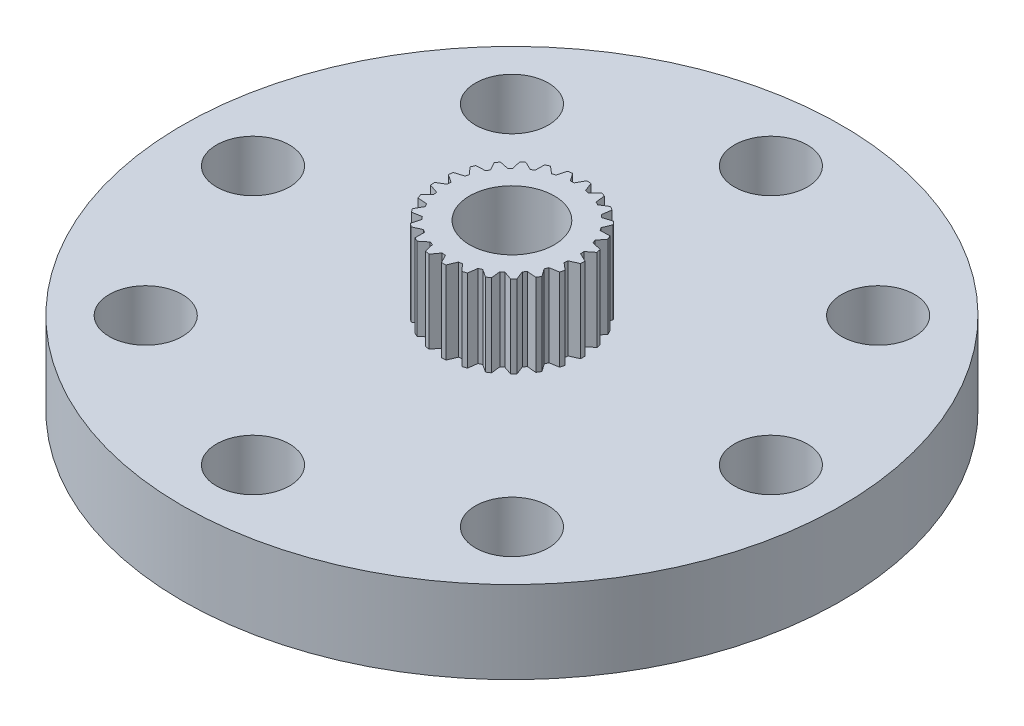
from build123d import *

# Parameters (mm, degrees)
SKETCH1_R                  = 14
BOSS_EXTRUDE1_DEPTH        = 1.75
M2_5_CLEARANCE_HOLE1_D     = 3.1
M2_5_CLEARANCE_HOLE1_DEPTH = 6
M2_5_CLEARANCE_HOLE1_TIP   = 0.931333959
SKETCH7_R                  = 5
CUT_EXTRUDE1_DEPTH         = 2.3
BOSS_EXTRUDE3_DEPTH        = 3.5
M3_CLEARANCE_HOLE1_D       = 3.6
M3_CLEARANCE_HOLE1_DEPTH   = 6
M3_CLEARANCE_HOLE1_TIP     = 1.081549114


with BuildPart() as part:
    # Sketch1 → Boss-Extrude1 (new, symmetric)
    with BuildSketch(Plane(origin=(0, 0, 0), x_dir=(1, 0, 0), z_dir=(0, 1, 0))):
        with Locations(Location((0, 0, 0), (0, 0, 270))):
            Circle(SKETCH1_R)
    extrude(amount=BOSS_EXTRUDE1_DEPTH, both=True)

    # M2.5 Clearance Hole1
    with Locations(Plane(origin=(0, 1.75, 0), x_dir=(1, 0, 0), z_dir=(0, 1, 0))):
        with Locations((-11, 0), (-7.778174593, 7.778174593), (0, 11), (7.778174593, 7.778174593), (11, 0), (7.778174593, -7.778174593), (0, -11), (-7.778174593, -7.778174593)):
            Hole(M2_5_CLEARANCE_HOLE1_D / 2, depth=M2_5_CLEARANCE_HOLE1_DEPTH)
            with Locations((0, 0, -(M2_5_CLEARANCE_HOLE1_DEPTH + M2_5_CLEARANCE_HOLE1_TIP / 2))):  # 118° drill point
                Cone(0, M2_5_CLEARANCE_HOLE1_D / 2, M2_5_CLEARANCE_HOLE1_TIP, mode=Mode.SUBTRACT)

    # Sketch7 → Cut-Extrude1 (cut)
    with BuildSketch(Plane.XZ.offset(1.75)):
        with Locations(Location((0, 0, 0), (0, 0, 270))):
            Circle(SKETCH7_R)
    extrude(amount=-CUT_EXTRUDE1_DEPTH, mode=Mode.SUBTRACT)

    # Sketch8 → Boss-Extrude3 (add)
    with BuildSketch(Plane(origin=(0, 1.75, 0), x_dir=(1, 0, 0), z_dir=(0, 1, 0))):
        with BuildLine():
            Line((-0.128852443, -2.696923627), (0.057352661, -3.049460718))
            ThreePointArc((0.057352661, -3.049460718), (0.151245078, -3.04624768), (0.244993995, -3.040144395))
            Line((0.244993995, -3.040144395), (0.395362741, -2.670896535))
            ThreePointArc((0.395362741, -2.670896535), (0.470816738, -2.658633408), (0.545893326, -2.644239111))
            Line((0.545893326, -2.644239111), (0.813920864, -2.939393275))
            ThreePointArc((0.813920864, -2.939393275), (0.904064427, -2.912931086), (0.993350224, -2.883705139))
            Line((0.993350224, -2.883705139), (1.047166652, -2.488662694))
            ThreePointArc((1.047166652, -2.488662694), (1.117200406, -2.458020189), (1.18633861, -2.425407327))
            Line((1.18633861, -2.425407327), (1.519347425, -2.644632943))
            ThreePointArc((1.519347425, -2.644632943), (1.600078084, -2.596584319), (1.679290606, -2.546072084))
            Line((1.679290606, -2.546072084), (1.63317323, -2.150057022))
            ThreePointArc((1.63317323, -2.150057022), (1.693386265, -2.102960522), (1.752241875, -2.054178281))
            Line((1.752241875, -2.054178281), (2.1293078, -2.183700596))
            ThreePointArc((2.1293078, -2.183700596), (2.19555295, -2.11708461), (2.259714983, -2.048459957))
            Line((2.259714983, -2.048459957), (2.116561528, -1.676355361))
            ThreePointArc((2.116561528, -1.676355361), (2.163170436, -1.615764111), (2.208045339, -1.553877659))
            Line((2.208045339, -1.553877659), (2.605475935, -1.58555831))
            ThreePointArc((2.605475935, -1.58555831), (2.653073149, -1.504560688), (2.698153157, -1.422135556))
            Line((2.698153157, -1.422135556), (2.466958481, -1.097322127))
            ThreePointArc((2.466958481, -1.097322127), (2.497034654, -1.027043299), (2.525109194, -0.955941189))
            Line((2.525109194, -0.955941189), (2.917932434, -0.887789563))
            ThreePointArc((2.917932434, -0.887789563), (2.943891005, -0.797499685), (2.967056445, -0.706453148))
            Line((2.967056445, -0.706453148), (2.66234736, -0.449340108))
            ThreePointArc((2.66234736, -0.449340108), (2.674001, -0.373789578), (2.683511152, -0.297939418))
            Line((2.683511152, -0.297939418), (3.047044507, -0.134237734))
            ThreePointArc((3.047044507, -0.134237734), (3.049733363, -0.040328844), (3.049528665, 0.053618309))
            Line((3.049528665, 0.053618309), (2.690451163, 0.226875602))
            ThreePointArc((2.690451163, 0.226875602), (2.68295003, 0.302950716), (2.673298235, 0.378782983))
            Line((2.673298235, 0.378782983), (2.984699568, 0.627748746))
            ThreePointArc((2.984699568, 0.627748746), (2.963949757, 0.719376006), (2.940387783, 0.810320731))
            Line((2.940387783, 0.810320731), (2.549504025, 0.888835884))
            ThreePointArc((2.549504025, 0.888835884), (2.523319442, 0.960655502), (2.495112158, 1.031705055))
            Line((2.495112158, 1.031705055), (2.734814978, 1.350291464))
            ThreePointArc((2.734814978, 1.350291464), (2.691930287, 1.433879817), (2.646491522, 1.516107721))
            Line((2.646491522, 1.516107721), (2.248362172, 1.494947338))
            ThreePointArc((2.248362172, 1.494947338), (2.205139413, 1.55799877), (2.160149007, 1.619801305))
            Line((2.160149007, 1.619801305), (2.313091905, 1.987990402))
            ThreePointArc((2.313091905, 1.987990402), (2.250766937, 2.058287685), (2.186306467, 2.126632087))
            Line((2.186306467, 2.126632087), (1.805947455, 2.007125753))
            ThreePointArc((1.805947455, 2.007125753), (1.748402365, 2.057447246), (1.68945575, 2.106119481))
            Line((1.68945575, 2.106119481), (1.74602876, 2.500776593))
            ThreePointArc((1.74602876, 2.500776593), (1.668179623, 2.553365768), (1.588747735, 2.603532338))
            Line((1.588747735, 2.603532338), (1.250058417, 2.393189076))
            ThreePointArc((1.250058417, 2.393189076), (1.181806766, 2.427618744), (1.112607775, 2.460102424))
            Line((1.112607775, 2.460102424), (1.069256207, 2.856429793))
            ThreePointArc((1.069256207, 2.856429793), (0.980774447, 2.888006489), (0.89136214, 2.916843077))
            Line((0.89136214, 2.916843077), (0.615623612, 2.628879527))
            ThreePointArc((0.615623612, 2.628879527), (0.540953902, 2.645254028), (0.465850562, 2.659508085))
            Line((0.465850562, 2.659508085), (0.325298354, 3.032603004))
            ThreePointArc((0.325298354, 3.032603004), (0.231743607, 3.041183141), (0.137968984, 3.046877838))
            Line((0.137968984, 3.046877838), (-0.057493089, 2.699387809))
            ThreePointArc((-0.057493089, 2.699387809), (-0.133889085, 2.696678274), (-0.210177756, 2.691807071))
            Line((-0.210177756, 2.691807071), (-0.439099191, 3.018226615))
            ThreePointArc((-0.439099191, 3.018226615), (-0.531848537, 3.003271072), (-0.624093271, 2.985466059))
            Line((-0.624093271, 2.985466059), (-0.726997287, 2.600283627))
            ThreePointArc((-0.726997287, 2.600283627), (-0.800319329, 2.578660305), (-0.872999832, 2.55496992))
            Line((-0.872999832, 2.55496992), (-1.175906519, 2.814203948))
            ThreePointArc((-1.175906519, 2.814203948), (-1.262022681, 2.776652436), (-1.346941451, 2.736466467))
            Line((-1.346941451, 2.736466467), (-1.350821572, 2.337794062))
            ThreePointArc((-1.350821572, 2.337794062), (-1.416462566, 2.298615626), (-1.480968118, 2.257594612))
            Line((-1.480968118, 2.257594612), (-1.838827315, 2.433354496))
            ThreePointArc((-1.838827315, 2.433354496), (-1.912899299, 2.375566516), (-1.985156345, 2.315524624))
            Line((-1.985156345, 2.315524624), (-1.88976877, 1.928412299))
            ThreePointArc((-1.88976877, 1.928412299), (-1.943604251, 1.874140474), (-1.995881731, 1.818366332))
            Line((-1.995881731, 1.818366332), (-2.386207829, 1.899608433))
            ThreePointArc((-2.386207829, 1.899608433), (-2.443581419, 1.825215014), (-2.498636566, 1.749089852))
            Line((-2.498636566, 1.749089852), (-2.309974846, 1.397861298))
            ThreePointArc((-2.309974846, 1.397861298), (-2.348622132, 1.331906183), (-2.385386754, 1.264883407))
            Line((-2.385386754, 1.264883407), (-2.783654129, 1.246502985))
            ThreePointArc((-2.783654129, 1.246502985), (-2.820724331, 1.160178541), (-2.855118261, 1.072753333))
            Line((-2.855118261, 1.072753333), (-2.585036707, 0.779477531))
            ThreePointArc((-2.585036707, 0.779477531), (-2.606067447, 0.705983328), (-2.625009154, 0.631923206))
            Line((-2.625009154, 0.631923206), (-3.006193202, 0.51507517))
            ThreePointArc((-3.006193202, 0.51507517), (-3.02063076, 0.422243783), (-3.032202376, 0.329011776))
            Line((-3.032202376, 0.329011776), (-2.697671205, 0.112116324))
            ThreePointArc((-2.697671205, 0.112116324), (-2.69976396, 0.035700944), (-2.699692576, -0.040743054))
            Line((-2.699692576, -0.040743054), (-3.0398421, -0.248716711))
            ThreePointArc((-3.0398421, -0.248716711), (-3.030739849, -0.342222105), (-3.018762064, -0.435402801))
            Line((-3.018762064, -0.435402801), (-2.640801099, -0.562289564))
            ThreePointArc((-2.640801099, -0.562289564), (-2.623824375, -0.636824661), (-2.604744383, -0.710849278))
            Line((-2.604744383, -0.710849278), (-2.88248654, -0.996880808))
            ThreePointArc((-2.88248654, -0.996880808), (-2.850416406, -1.085184919), (-2.815641829, -1.172459418))
            Line((-2.815641829, -1.172459418), (-2.417999748, -1.201364731))
            ThreePointArc((-2.417999748, -1.201364731), (-2.383020254, -1.269336231), (-2.346130522, -1.336290227))
            Line((-2.346130522, -1.336290227), (-2.544013749, -1.682407216))
            ThreePointArc((-2.544013749, -1.682407216), (-2.490990819, -1.759961574), (-2.435604463, -1.835846099))
            Line((-2.435604463, -1.835846099), (-2.04326658, -1.764953733))
            ThreePointArc((-2.04326658, -1.764953733), (-1.992482207, -1.822090738), (-1.940100652, -1.877767147))
            Line((-1.940100652, -1.877767147), (-2.045691219, -2.262221792))
            ThreePointArc((-2.045691219, -2.262221792), (-1.975047116, -2.32415337), (-1.902529111, -2.383879817))
            Line((-1.902529111, -2.383879817), (-1.540147459, -2.217644202))
            ThreePointArc((-1.540147459, -2.217644202), (-1.476749174, -2.260356582), (-1.412167122, -2.301257052))
            Line((-1.412167122, -2.301257052), (-1.418830385, -2.699892653))
            ThreePointArc((-1.418830385, -2.699892653), (-1.33500394, -2.742310063), (-1.249910858, -2.782125599))
            Line((-1.249910858, -2.782125599), (-0.940255208, -2.530991929))
            ThreePointArc((-0.940255208, -2.530991929), (-0.86822656, -2.556595909), (-0.795501939, -2.580150512))
            Line((-0.795501939, -2.580150512), (-0.70281922, -2.967919329))
            ThreePointArc((-0.70281922, -2.967919329), (-0.611077556, -2.988157329), (-0.518756109, -3.005560197))
            Line((-0.518756109, -3.005560197), (-0.281283264, -2.685308125))
            ThreePointArc((-0.281283264, -2.685308125), (-0.205150078, -2.692194912), (-0.128852443, -2.696923627))
        make_face()
    extrude(amount=BOSS_EXTRUDE3_DEPTH)

    # M3 Clearance Hole1
    with Locations(Plane(origin=(0, 5.25, 0), x_dir=(1, 0, 0), z_dir=(0, 1, 0))):
        with Locations((0, 0)):
            Hole(M3_CLEARANCE_HOLE1_D / 2, depth=M3_CLEARANCE_HOLE1_DEPTH)
            with Locations((0, 0, -(M3_CLEARANCE_HOLE1_DEPTH + M3_CLEARANCE_HOLE1_TIP / 2))):  # 118° drill point
                Cone(0, M3_CLEARANCE_HOLE1_D / 2, M3_CLEARANCE_HOLE1_TIP, mode=Mode.SUBTRACT)


solid = part.part
